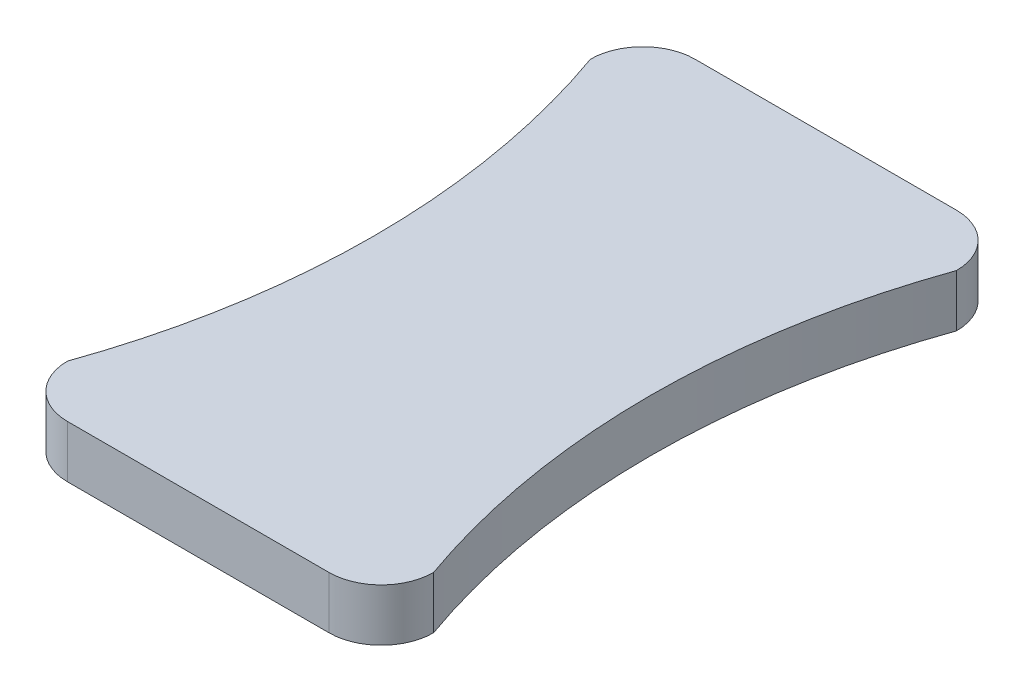
from build123d import *

# Parameters (mm, degrees)
BOSS_EXTRUDE1_DEPTH = 10


with BuildPart() as part:
    # Sketch2 → Boss-Extrude1 (new body)
    with BuildSketch(Plane(origin=(0, 0, 0), x_dir=(1, 0, 0), z_dir=(0, 1, 0))):
        with BuildLine():
            Line((-25, 60), (25, 60))
            ThreePointArc((25, 60), (32.071067812, 57.071067812), (35, 50))
            ThreePointArc((35, 50), (26.421356237, 0), (35, -50))
            ThreePointArc((35, -50), (32.071067812, -57.071067812), (25, -60))
            Line((25, -60), (-25, -60))
            ThreePointArc((-25, -60), (-32.071067812, -57.071067812), (-35, -50))
            ThreePointArc((-35, -50), (-26.421356237, 0), (-35, 50))
            ThreePointArc((-35, 50), (-32.071067812, 57.071067812), (-25, 60))
        make_face()
    extrude(amount=BOSS_EXTRUDE1_DEPTH)


solid = part.part
